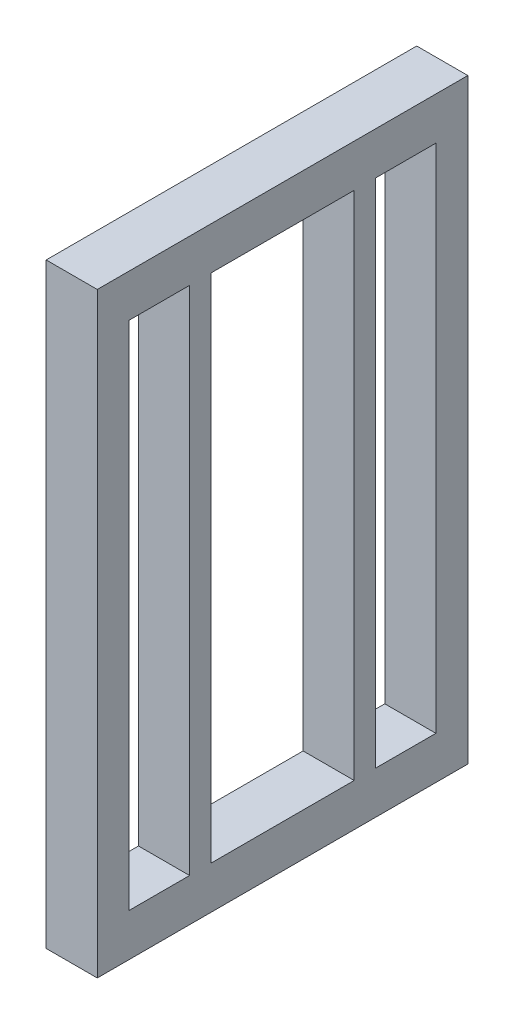
from build123d import *

# Parameters (mm, degrees)
SKETCH1_W           = 4.8
SKETCH1_H           = 34.8
BOSS_EXTRUDE1_DEPTH = 56
SKETCH2_W           = 5.67
SKETCH2_H           = 48
SKETCH2_W_2         = 13.46
CUT_EXTRUDE1_DEPTH  = 56


with BuildPart() as part:
    # Sketch1 → Boss-Extrude1 (new body)
    with BuildSketch(Plane(origin=(0, 0, 0), x_dir=(1, 0, 0), z_dir=(0, 1, 0))):
        with Locations((-0.073796791, 12.667379679)):
            Rectangle(SKETCH1_W, SKETCH1_H)
    extrude(amount=BOSS_EXTRUDE1_DEPTH)

    # Sketch2 → Cut-Extrude1 (cut)
    with BuildSketch(Plane(origin=(2.326203209, 0, 0), x_dir=(0, 0, -1), z_dir=(1, 0, 0))):
        with Locations((1.102379679, 28)):
            Rectangle(SKETCH2_W, SKETCH2_H)
        with Locations((12.667379679, 28)):
            Rectangle(SKETCH2_W_2, SKETCH2_H)
        with Locations((24.232379679, 28)):
            Rectangle(SKETCH2_W, SKETCH2_H)
    extrude(amount=-CUT_EXTRUDE1_DEPTH, mode=Mode.SUBTRACT)


solid = part.part
